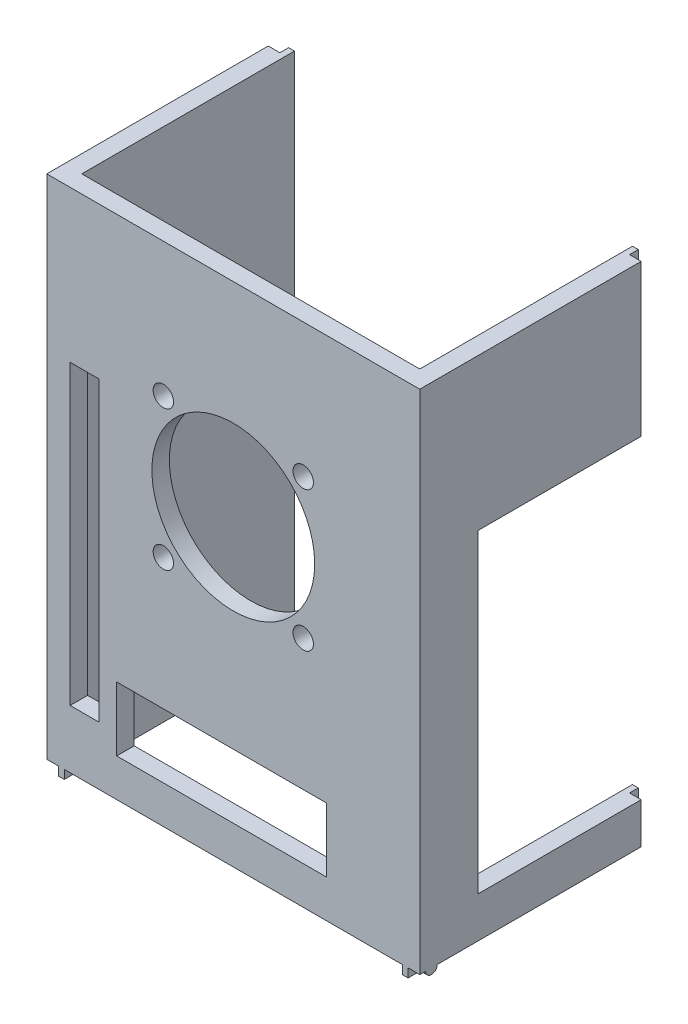
from build123d import *

# Parameters (mm, degrees)
EXTRUDE_1_DEPTH      = 88
SKETCH_3_W           = 1.5000000000000007
SKETCH_3_H           = 22
SKETCH_3_W_2         = 1.5
EXTRUDE_2_DEPTH      = 3
CUT_EXTRUDE_1_DEPTH  = 13.000000000000005
CUT_EXTRUDE_2_DEPTH  = 6
SKETCH_7_W           = 1.5
SKETCH_7_H           = 3
SKETCH_7_W_2         = 1.5000000000000007
EXTRUDE_4_DEPTH      = 3
EXTRUDE_START        = -62
SKETCH_6_R           = 1.0000000000000016
EXTRUDE_7_DEPTH      = 62
EXTRUDE_START_2      = 1
EXTRUDE_8_DEPTH      = 1
EXTRUDE_9_DEPTH      = 1
EXTRUDE_10_DEPTH     = 1
EXTRUDE_11_DEPTH     = 1
EXTRUDE_12_DEPTH     = 1
CUT_EXTRUDE_3_DEPTH  = 1
CUT_EXTRUDE_START    = -1
CUT_EXTRUDE_4_DEPTH  = 1
CUT_EXTRUDE_5_DEPTH  = 1
SKETCH_16_W          = 1.500000000000007
SKETCH_16_H          = 25
CUT_EXTRUDE_6_DEPTH  = 1
SKETCH_17_W          = 1.5000000000000004
SKETCH_17_H          = 90
CUT_EXTRUDE_7_DEPTH  = 1
CUT_EXTRUDE_8_DEPTH  = 1
SKETCH_19_W          = 1.500000000000007
SKETCH_19_H          = 26.999999999999993
CUT_EXTRUDE_9_DEPTH  = 1
EXTRUDE_13_DEPTH     = 1
CUT_EXTRUDE_10_DEPTH = 1
CUT_EXTRUDE_11_DEPTH = 1
CUT_EXTRUDE_12_DEPTH = 0.5
CUT_EXTRUDE_13_DEPTH = 0.5
CUT_EXTRUDE_14_DEPTH = 0.5
SKETCH_26_W          = 1.500000000000007
SKETCH_26_H          = 25.999999999999993
CUT_EXTRUDE_15_DEPTH = 0.5
CUT_EXTRUDE_16_DEPTH = 0.5
CUT_EXTRUDE_START_2  = -0.5
CUT_EXTRUDE_17_DEPTH = 0.5
SKETCH_29_W          = 1.4999999999999991
SKETCH_29_H          = 25.999999999999993
CUT_EXTRUDE_18_DEPTH = 0.5
CUT_EXTRUDE_19_DEPTH = 0.5
EXTRUDE_14_DEPTH     = 15
CUT_EXTRUDE_20_DEPTH = 15
SKETCH_33_R          = 1.0000000000000016
CUT_EXTRUDE_21_DEPTH = 114.62339335608438
CUT_EXTRUDE_22_DEPTH = 2
EXTRUDE_15_DEPTH     = 26.00000000000001
EXTRUDE_16_DEPTH     = 26.00000000000001
SKETCH_37_W          = 2.0000000000000004
SKETCH_37_H          = 87
EXTRUDE_17_DEPTH     = 26.00000000000001
EXTRUDE_18_DEPTH     = 28.000000000000025
SKETCH_40_R          = 1.7500000000000038
SKETCH_40_R_2        = 13.967693526781561
SKETCH_40_R_3        = 4.000000000000002
SKETCH_40_R_4        = 4
CUT_EXTRUDE_23_DEPTH = 28.000000000000025
CUT_EXTRUDE_25_DEPTH = 22.000000000000007
SKETCH_43_W          = 11.493047427713066
SKETCH_43_H          = 3
SKETCH_43_W_2        = 11.493047427713059
EXTRUDE_19_DEPTH     = 73.00000000000001
CUT_EXTRUDE_26_DEPTH = 73.00000000000001
EXTRUDE_START_3      = -64
SKETCH_45_R          = 0.9999999999999983
EXTRUDE_21_DEPTH     = 64


with BuildPart() as part:
    # 草图2 → 凸台-拉伸1 (new body)
    with BuildSketch(Plane(origin=(0, 0, 0), x_dir=(1, 0, 0), z_dir=(0, 1, 0))):
        Polygon((-3.2692307692307776, 5.711538461538465), (-3.269230769230777, 2.711538461538465), (-4.769230769230776, 2.711538461538465), (-4.7692307692307745, -19.288461538461533), (57.230769230769226, -19.288461538461533), (57.230769230769226, 2.7115384615384723), (55.73076923076922, 2.7115384615384723), (55.73076923076922, 5.711538461538472), (54.23076923076922, 5.711538461538473), (54.23076923076922, -16.288461538461526), (-1.7692307692307774, -16.288461538461533), (-1.7692307692307776, 5.711538461538466), align=None)
    extrude(amount=EXTRUDE_1_DEPTH)

    # 草图3 → 凸台-拉伸2 (add)
    with BuildSketch(Plane.XZ):
        with Locations((-2.5192307692307776, 5.288461538461534)):
            Rectangle(SKETCH_3_W, SKETCH_3_H)
        with Locations((54.98076923076922, 5.288461538461534)):
            Rectangle(SKETCH_3_W_2, SKETCH_3_H)
    extrude(amount=EXTRUDE_2_DEPTH)

    # 草图4 → 切除-拉伸1 (cut)
    with BuildSketch(Plane(origin=(0, 0, -2.7115384615384723), x_dir=(-1, 0, 0), z_dir=(0, 0, -1))):
        Polygon((-55.73076923076922, 16.689999999999998), (-54.23076923076922, 16.69), (-54.23076923076922, 44.69), (-55.73076923076922, 44.69), align=None)
    extrude(amount=CUT_EXTRUDE_1_DEPTH, mode=Mode.SUBTRACT)

    # 草图5 → 切除-拉伸2 (cut, symmetric)
    with BuildSketch(Plane(origin=(0, 0, -2.7115384615384723), x_dir=(-1, 0, 0), z_dir=(0, 0, -1))):
        Polygon((-57.230769230769226, 8.999999999999995), (-54.23076923076922, 8.999999999999998), (-54.23076923076922, 61), (-57.230769230769226, 61), align=None)
    extrude(amount=CUT_EXTRUDE_2_DEPTH, both=True, mode=Mode.SUBTRACT)

    # 草图7 → 凸台-拉伸4 (add)
    with BuildSketch(Plane.XY.offset(16.288461538461533)):
        with Locations((54.98076923076922, -1.5)):
            Rectangle(SKETCH_7_W, SKETCH_7_H)
        with Locations((-2.5192307692307776, -1.5)):
            Rectangle(SKETCH_7_W_2, SKETCH_7_H)
    extrude(amount=EXTRUDE_4_DEPTH)

    # 草图6 → 凸台-拉伸7 (add)
    with BuildSketch(Plane.ZY.offset(4.769230769230776).offset(EXTRUDE_START)):
        with Locations((17.28846154, 0)):
            Circle(SKETCH_6_R)
    extrude(amount=EXTRUDE_7_DEPTH)

    # 草图8 → 凸台-拉伸8 (add)
    with BuildSketch(Plane(origin=(57.230769230769226, 0, 0), x_dir=(0, 0, -1), z_dir=(1, 0, 0)).offset(EXTRUDE_START_2)):
        with BuildLine():
            Line((-19.288461538461533, 0), (-18.28846154, 0))
            ThreePointArc((-18.28846154, 0), (-17.288461539999997, -1.0000000000000036), (-16.288461539999997, 0))
            Line((-16.288461539999997, 0), (2.7115384615384723, 0))
            Line((2.7115384615384723, 0), (2.7115384615384723, 8.999999999999995))
            Line((2.7115384615384723, 8.999999999999995), (-3.288461538461528, 8.999999999999995))
            Line((-3.288461538461528, 8.999999999999995), (-3.288461538461528, 61))
            Line((-3.288461538461528, 61), (2.711538461538472, 61))
            Line((2.711538461538472, 61), (2.7115384615384723, 88))
            Line((2.7115384615384723, 88), (-19.288461538461533, 88))
            Line((-19.288461538461533, 88), (-19.288461538461533, 0))
        make_face()
    extrude(amount=-EXTRUDE_8_DEPTH)

    # 草图9 → 凸台-拉伸9 (add)
    with BuildSketch(Plane.ZY.offset(4.769230769230776)):
        with BuildLine():
            Line((-2.7115384615384652, 0), (16.28846154, 0))
            ThreePointArc((16.28846154, 0), (17.28846154, -1), (18.288461540000004, 0))
            Line((18.288461540000004, 0), (19.288461538461533, 0))
            Line((19.288461538461533, 0), (19.288461538461533, 88))
            Line((19.288461538461533, 88), (-2.7115384615384652, 88))
            Line((-2.7115384615384652, 88), (-2.7115384615384652, 0))
        make_face()
    extrude(amount=EXTRUDE_9_DEPTH)

    # 草图10 → 凸台-拉伸10 (add)
    with BuildSketch(Plane.ZY.offset(3.2692307692307767)):
        with BuildLine():
            Line((19.288461538461533, 0), (18.288461540000004, 0))
            ThreePointArc((18.288461540000004, 0), (17.28846154, -1), (16.28846154, 1.2e-16))
            Line((16.28846154, 1.2e-16), (-2.7115384615384652, 0))
            Line((-2.7115384615384652, 0), (-2.7115384615384652, 88))
            Line((-2.7115384615384652, 88), (-5.711538461538466, 88))
            Line((-5.711538461538466, 88), (-5.711538461538466, -3))
            Line((-5.711538461538466, -3), (19.288461538461533, -3))
            Line((19.288461538461533, -3), (19.288461538461533, 0))
        make_face()
    extrude(amount=EXTRUDE_10_DEPTH)

    # 草图11 → 凸台-拉伸11 (add)
    with BuildSketch(Plane(origin=(55.73076923076922, 0, 0), x_dir=(0, 0, -1), z_dir=(1, 0, 0)).offset(EXTRUDE_START_2)):
        with BuildLine():
            Line((2.7115384615384723, 0), (-16.288461539999997, 0))
            ThreePointArc((-16.288461539999997, 0), (-17.288461539999997, -1.0000000000000036), (-18.28846154, 1.2e-16))
            Line((-18.28846154, 1.2e-16), (-19.288461538461533, 0))
            Line((-19.288461538461533, 0), (-19.288461538461533, -3))
            Line((-19.288461538461533, -3), (5.711538461538465, -3))
            Line((5.711538461538465, -3), (5.711538461538476, 8.999999999999995))
            Line((5.711538461538476, 8.999999999999995), (2.7115384615384723, 8.999999999999996))
            Line((2.7115384615384723, 8.999999999999996), (2.7115384615384723, 0))
        make_face()
    extrude(amount=-EXTRUDE_11_DEPTH)

    # 草图12 → 凸台-拉伸12 (add)
    with BuildSketch(Plane(origin=(55.73076923076922, 0, 0), x_dir=(0, 0, -1), z_dir=(1, 0, 0))):
        Polygon((2.7115384615384723, 88), (2.7115384615384723, 61), (5.711538461538476, 61), (5.711538461538472, 88), align=None)
    extrude(amount=EXTRUDE_12_DEPTH)

    # 草图13 → 切除-拉伸3 (cut)
    with BuildSketch(Plane(origin=(-1.7692307692307776, 0, 3e-17), x_dir=(-2e-17, 0, -1), z_dir=(1, 0, -2e-17))):
        with BuildLine():
            Line((-16.288461538461533, 88), (-16.28846154, 0))
            ThreePointArc((-16.28846154, 0), (-17.28846154, -1.0000000000000036), (-18.288461540000004, 1.2e-16))
            Line((-18.288461540000004, 1.2e-16), (-19.288461538461533, 0))
            Line((-19.288461538461533, 0), (-19.288461538461533, -3))
            Line((-19.288461538461533, -3), (5.711538461538465, -3))
            Line((5.711538461538465, -3), (5.711538461538466, 88))
            Line((5.711538461538466, 88), (-16.288461538461533, 88))
        make_face()
    extrude(amount=-CUT_EXTRUDE_3_DEPTH, mode=Mode.SUBTRACT)

    # 草图14 → 切除-拉伸4 (cut)
    with BuildSketch(Plane.ZY.offset(-54.23076923076922).offset(CUT_EXTRUDE_START)):
        with BuildLine():
            Line((19.288461538461533, 0), (18.28846154, 0))
            ThreePointArc((18.28846154, 0), (17.288461539999997, -1.0000000003846203), (16.288461539615376, 1.2e-16))
            Line((16.288461539615376, 1.2e-16), (16.288461538461526, 88))
            Line((16.288461538461526, 88), (-5.711538461538473, 88))
            Line((-5.711538461538473, 88), (-5.711538461538476, 61))
            Line((-5.711538461538476, 61), (3.288461538461528, 61))
            Line((3.288461538461528, 61), (3.288461538461528, 8.999999999999998))
            Line((3.288461538461528, 8.999999999999998), (-5.711538461538476, 8.999999999999998))
            Line((-5.711538461538476, 8.999999999999998), (-5.711538461538465, -3))
            Line((-5.711538461538465, -3), (19.288461538461533, -3))
            Line((19.288461538461533, -3), (19.288461538461533, 0))
        make_face()
    extrude(amount=CUT_EXTRUDE_4_DEPTH, mode=Mode.SUBTRACT)

    # 草图15 → 切除-拉伸5 (cut)
    with BuildSketch(Plane.XZ.offset(3)):
        Polygon((-2.7692307692307776, -5.711538461538465), (-2.769230769230777, 19.288461538461533), (-4.2692307692307745, 19.288461538461533), (-4.269230769230778, -5.711538461538465), align=None)
    extrude(amount=-CUT_EXTRUDE_5_DEPTH, mode=Mode.SUBTRACT)

    # 草图16 → 切除-拉伸6 (cut)
    with BuildSketch(Plane.XZ.offset(3)):
        with Locations((55.980769230769226, 6.788461538461534)):
            Rectangle(SKETCH_16_W, SKETCH_16_H)
    extrude(amount=-CUT_EXTRUDE_6_DEPTH, mode=Mode.SUBTRACT)

    # 草图17 → 切除-拉伸7 (cut)
    with BuildSketch(Plane(origin=(-3.3e-15, 0, -5.711538461538467), x_dir=(-1, 0, 5.8e-16), z_dir=(-5.8e-16, 0, -1))):
        with Locations((3.5192307692307745, 43)):
            Rectangle(SKETCH_17_W, SKETCH_17_H)
    extrude(amount=-CUT_EXTRUDE_7_DEPTH, mode=Mode.SUBTRACT)

    # 草图18 → 切除-拉伸8 (cut)
    with BuildSketch(Plane(origin=(3.3e-15, 0, -5.711538461538505), x_dir=(-1, 0, -5.8e-16), z_dir=(5.8e-16, 0, -1))):
        Polygon((-56.730769230769226, -2), (-55.23076923076922, -2), (-55.23076923076922, 8.999999999999998), (-56.730769230769226, 8.999999999999995), align=None)
    extrude(amount=-CUT_EXTRUDE_8_DEPTH, mode=Mode.SUBTRACT)

    # 草图19 → 切除-拉伸9 (cut)
    with BuildSketch(Plane(origin=(3.3e-15, 0, -5.711538461538505), x_dir=(-1, 0, -5.8e-16), z_dir=(5.8e-16, 0, -1))):
        with Locations((-55.980769230769226, 74.5)):
            Rectangle(SKETCH_19_W, SKETCH_19_H)
    extrude(amount=-CUT_EXTRUDE_9_DEPTH, mode=Mode.SUBTRACT)

    # 草图20 → 凸台-拉伸13 (add)
    with BuildSketch(Plane.XY.offset(19.288461538461533)):
        Polygon((55.23076923076922, -2), (56.730769230769226, -2), (56.730769230769226, 0), (58.230769230769226, 0), (58.230769230769226, 88), (-5.7692307692307745, 88), (-5.7692307692307745, 0), (-4.2692307692307745, 0), (-4.2692307692307745, -2), (-2.769230769230777, -2), (-2.769230769230777, 0), (55.23076923076922, 0), align=None)
    extrude(amount=EXTRUDE_13_DEPTH)

    # 草图21 → 切除-拉伸10 (cut)
    with BuildSketch(Plane(origin=(2.02e-15, 0, 16.288461538461533), x_dir=(-1, 0, 1.2e-16), z_dir=(-1.2e-16, 0, -1))):
        Polygon((-55.23076923076922, 1.2e-16), (2.7692307692307794, 0), (2.7692307692307794, 88), (-55.23076923076922, 88), align=None)
    extrude(amount=-CUT_EXTRUDE_10_DEPTH, mode=Mode.SUBTRACT)

    # 草图22 → 切除-拉伸11 (cut)
    with BuildSketch(Plane(origin=(0, 88, 0), x_dir=(1, 0, 0), z_dir=(0, 1, 0))):
        Polygon((55.23076923076922, 4.711538461538472), (55.23076923076922, -17.288461538461526), (-2.769230769230777, -17.288461538461533), (-2.769230769230777, 4.711538461538465), (-4.269230769230777, 4.711538461538464), (-4.269230769230776, 2.711538461538465), (-5.769230769230776, 2.711538461538465), (-5.7692307692307745, -20.288461538461533), (58.230769230769226, -20.288461538461533), (58.230769230769226, 2.7115384615384723), (56.730769230769226, 2.7115384615384723), (56.730769230769226, 4.7115384615384714), align=None)
    extrude(amount=-CUT_EXTRUDE_11_DEPTH, mode=Mode.SUBTRACT)

    # 草图23 → 切除-拉伸12 (cut)
    with BuildSketch(Plane.XZ.offset(2)):
        Polygon((-4.2692307692307745, 20.288461538461533), (-4.269230769230777, -4.711538461538464), (-2.7692307692307776, -4.711538461538465), (-2.769230769230777, 20.288461538461533), align=None)
    extrude(amount=-CUT_EXTRUDE_12_DEPTH, mode=Mode.SUBTRACT)

    # 草图24 → 切除-拉伸13 (cut)
    with BuildSketch(Plane.XZ.offset(2)):
        Polygon((55.23076923076922, 20.288461538461533), (55.23076923076922, -4.711538461538472), (56.730769230769226, -4.7115384615384714), (56.730769230769226, 20.288461538461533), align=None)
    extrude(amount=-CUT_EXTRUDE_13_DEPTH, mode=Mode.SUBTRACT)

    # 草图25 → 切除-拉伸14 (cut)
    with BuildSketch(Plane(origin=(-2.72e-15, 0, -4.711538461538467), x_dir=(-1, 0, 5.8e-16), z_dir=(-5.8e-16, 0, -1))):
        Polygon((2.7692307692307745, 87), (2.769230769230775, -1.5), (4.2692307692307745, -1.5), (4.2692307692307745, 87), align=None)
    extrude(amount=-CUT_EXTRUDE_14_DEPTH, mode=Mode.SUBTRACT)

    # 草图26 → 切除-拉伸15 (cut)
    with BuildSketch(Plane(origin=(2.72e-15, 0, -4.711538461538505), x_dir=(-1, 0, -5.8e-16), z_dir=(5.8e-16, 0, -1))):
        with Locations((-55.980769230769226, 74)):
            Rectangle(SKETCH_26_W, SKETCH_26_H)
    extrude(amount=-CUT_EXTRUDE_15_DEPTH, mode=Mode.SUBTRACT)

    # 草图27 → 切除-拉伸16 (cut)
    with BuildSketch(Plane(origin=(2.72e-15, 0, -4.711538461538505), x_dir=(-1, 0, -5.8e-16), z_dir=(5.8e-16, 0, -1))):
        Polygon((-56.730769230769226, 8.999999999999995), (-56.730769230769226, -1.5), (-55.23076923076922, -1.5), (-55.23076923076922, 8.999999999999998), align=None)
    extrude(amount=-CUT_EXTRUDE_16_DEPTH, mode=Mode.SUBTRACT)

    # 草图28 → 切除-拉伸17 (cut)
    with BuildSketch(Plane.ZY.offset(4.269230769230777).offset(CUT_EXTRUDE_START_2)):
        with BuildLine():
            Line((-2.7115384615384652, 87), (-4.211538461538465, 87))
            Line((-4.211538461538465, 87), (-4.211538461538465, -1.5))
            Line((-4.211538461538465, -1.5), (20.288461538461533, -1.5))
            Line((20.288461538461533, -1.5), (20.288461538461533, 0))
            Line((20.288461538461533, 0), (18.288461540000004, 0))
            ThreePointArc((18.288461540000004, 0), (17.28846154, -1), (16.28846154, 1.2e-16))
            Line((16.28846154, 1.2e-16), (-2.7115384615384652, 0))
            Line((-2.7115384615384652, 0), (-2.7115384615384652, 87))
        make_face()
    extrude(amount=CUT_EXTRUDE_17_DEPTH, mode=Mode.SUBTRACT)

    # 草图29 → 切除-拉伸18 (cut)
    with BuildSketch(Plane(origin=(56.730769230769226, 0, 0), x_dir=(0, 0, -1), z_dir=(1, 0, 0))):
        with Locations((3.461538461538472, 74)):
            Rectangle(SKETCH_29_W, SKETCH_29_H)
    extrude(amount=-CUT_EXTRUDE_18_DEPTH, mode=Mode.SUBTRACT)

    # 草图30 → 切除-拉伸19 (cut)
    with BuildSketch(Plane(origin=(56.730769230769226, 0, 0), x_dir=(0, 0, -1), z_dir=(1, 0, 0))):
        with BuildLine():
            Line((-20.288461538461533, -1.5), (4.2115384615384714, -1.5))
            Line((4.2115384615384714, -1.5), (4.2115384615384714, 8.999999999999995))
            Line((4.2115384615384714, 8.999999999999995), (2.7115384615384723, 8.999999999999995))
            Line((2.7115384615384723, 8.999999999999995), (2.7115384615384723, 0))
            Line((2.7115384615384723, 0), (-16.288461539999997, 0))
            ThreePointArc((-16.288461539999997, 0), (-17.288461539999997, -1.0000000000000036), (-18.28846154, 1.2e-16))
            Line((-18.28846154, 1.2e-16), (-20.288461538461533, 0))
            Line((-20.288461538461533, 0), (-20.288461538461533, -1.5))
        make_face()
    extrude(amount=-CUT_EXTRUDE_19_DEPTH, mode=Mode.SUBTRACT)

    # 草图31 → 凸台-拉伸14 (add)
    with BuildSketch(Plane.XY.offset(20.288461538461533)):
        Polygon((56.230769230769226, -1.5), (56.230769230769226, 0), (58.230769230769226, 0), (58.230769230769226, 87), (-5.7692307692307745, 87), (-5.7692307692307745, 0), (-3.7692307692307745, 0), (-3.7692307692307745, -1.5), (-2.769230769230777, -1.5), (-2.769230769230777, 0), (55.23076923076922, 0), (55.23076923076922, -1.5), align=None)
    extrude(amount=EXTRUDE_14_DEPTH)

    # 草图32 → 切除-拉伸20 (cut)
    with BuildSketch(Plane(origin=(2.07e-15, 0, 17.288461538461533), x_dir=(-1, 0, 1.2e-16), z_dir=(-1.2e-16, 0, -1))):
        Polygon((2.7692307692307794, 0), (2.7692307692307794, 87), (-55.23076923076922, 87), (-55.23076923076922, 1.2e-16), align=None)
    extrude(amount=-CUT_EXTRUDE_20_DEPTH, mode=Mode.SUBTRACT)

    # 草图33 → 切除-拉伸21 (cut, through all)
    with BuildSketch(Plane.ZY.offset(5.769230769230776)):
        with Locations((17.28846154, 0)):
            Circle(SKETCH_33_R)
    extrude(amount=-CUT_EXTRUDE_21_DEPTH, mode=Mode.SUBTRACT)

    # 草图34 → 切除-拉伸22 (cut)
    with BuildSketch(Plane(origin=(1.041e-14, 9.00000000000006, 0), x_dir=(1, -1.16e-15, 0), z_dir=(1.16e-15, 1, 0))):
        Polygon((58.23076923076922, 2.7115384615384723), (56.23076923076922, 2.7115384615384723), (56.23076923076922, 4.2115384615384714), (55.23076923076921, 4.211538461538473), (55.23076923076921, -3.288461538461528), (58.23076923076922, -3.288461538461528), align=None)
    extrude(amount=-CUT_EXTRUDE_22_DEPTH, mode=Mode.SUBTRACT)

    # 草图35 → 凸台-拉伸15 (add)
    with BuildSketch(Plane(origin=(0, 0, -2.7115384615384723), x_dir=(-1, 0, 0), z_dir=(0, 0, -1))):
        Polygon((-56.230769230769226, 6.999999999999996), (-58.23076923076923, 6.999999999999992), (-58.230769230769226, 0), (-56.230769230769226, 0), align=None)
    extrude(amount=-EXTRUDE_15_DEPTH)

    # 草图36 → 凸台-拉伸16 (add)
    with BuildSketch(Plane(origin=(2.44e-15, 0, -4.211538461538504), x_dir=(-1, 0, -5.8e-16), z_dir=(5.8e-16, 0, -1))):
        Polygon((-55.23076923076922, -1.5), (-55.230769230769226, 6.999999999999996), (-56.23076923076923, 6.999999999999996), (-56.230769230769226, -1.5), align=None)
    extrude(amount=-EXTRUDE_16_DEPTH)

    # 草图37 → 凸台-拉伸17 (add)
    with BuildSketch(Plane(origin=(0, 0, -2.711538461538465), x_dir=(-1, 0, 0), z_dir=(0, 0, -1))):
        with Locations((4.769230769230777, 43.5)):
            Rectangle(SKETCH_37_W, SKETCH_37_H)
    extrude(amount=-EXTRUDE_17_DEPTH)

    # 草图38 → 凸台-拉伸18 (add)
    with BuildSketch(Plane(origin=(-2.44e-15, 0, -4.211538461538466), x_dir=(-1, 0, 5.8e-16), z_dir=(-5.8e-16, 0, -1))):
        Polygon((2.769230769230775, -1.5), (3.769230769230775, -1.5), (3.7692307692307745, 87), (2.769230769230774, 87), align=None)
    extrude(amount=-EXTRUDE_18_DEPTH)

    # 草图40 → 切除-拉伸23 (cut)
    with BuildSketch(Plane.XY.offset(35.28846153846153)):
        with Locations((38.23076923076923, 64)):
            Circle(SKETCH_40_R)
        with Locations((38.23076923076923, 40.00000000000002)):
            Circle(SKETCH_40_R)
        with Locations((14.23076923076921, 40.00000000000002)):
            Circle(SKETCH_40_R)
        with Locations((14.23076923076921, 64)):
            Circle(SKETCH_40_R)
        with Locations((26.230769230769226, 52.000000000000014)):
            Circle(SKETCH_40_R_2)
        with Locations((6.236788059331033, 52.000000000000014)):
            Circle(SKETCH_40_R_3)
        with Locations((6.236788059331033, 75.99999999999999)):
            Circle(SKETCH_40_R_3)
        with Locations((6.236788059331033, 28.000000000000032)):
            Circle(SKETCH_40_R_3)
        with Locations((46.224750402207405, 28.000000000000032)):
            Circle(SKETCH_40_R_4)
        with Locations((46.22475040220741, 52.000000000000014)):
            Circle(SKETCH_40_R_4)
        with Locations((46.22475040220741, 75.99999999999999)):
            Circle(SKETCH_40_R_4)
    extrude(amount=-CUT_EXTRUDE_23_DEPTH, mode=Mode.SUBTRACT)

    # 草图41 → 切除-拉伸25 (cut)
    with BuildSketch(Plane(origin=(0, 0, 3.288461538461528), x_dir=(-1, 0, 0), z_dir=(0, 0, -1))):
        Polygon((-55.230769230769226, 6.999999999999996), (-55.23076923076922, 61), (-58.230769230769226, 61), (-58.23076923076923, 6.999999999999992), align=None)
    extrude(amount=-CUT_EXTRUDE_25_DEPTH, mode=Mode.SUBTRACT)

    # 草图43 → 凸台-拉伸19 (add)
    with BuildSketch(Plane(origin=(0, 87, 0), x_dir=(1, 0, 0), z_dir=(0, 1, 0))):
        with Locations((5.746523713856533, -33.78846153846153)):
            Rectangle(SKETCH_43_W, SKETCH_43_H)
        with Locations((46.95722324843743, -33.78846153846153)):
            Rectangle(SKETCH_43_W_2, SKETCH_43_H)
    extrude(amount=-EXTRUDE_19_DEPTH)

    # 草图44 → 切除-拉伸26 (cut)
    with BuildSketch(Plane.XY.offset(35.28846153846153)):
        Polygon((42.23076923076923, 17.5), (6.230769230769234, 17.499999999999996), (6.230769230769234, 6.4999999999999964), (42.23076923076923, 6.500000000000001), align=None)
        Polygon((-1.7692307692307747, 60.99999999999999), (3.230769230769228, 60.99999999999999), (3.2307692307692415, 9.999999999999996), (-1.7692307692307683, 9.999999999999995), align=None)
    extrude(amount=-CUT_EXTRUDE_26_DEPTH, mode=Mode.SUBTRACT)

    # 草图45 → 凸台-拉伸21 (add)
    with BuildSketch(Plane(origin=(58.230769230769226, 0, 0), x_dir=(0, 0, -1), z_dir=(1, 0, 0)).offset(EXTRUDE_START_3)):
        with Locations((-33.28846153846153, 0)):
            Circle(SKETCH_45_R)
    extrude(amount=EXTRUDE_21_DEPTH)


solid = part.part
